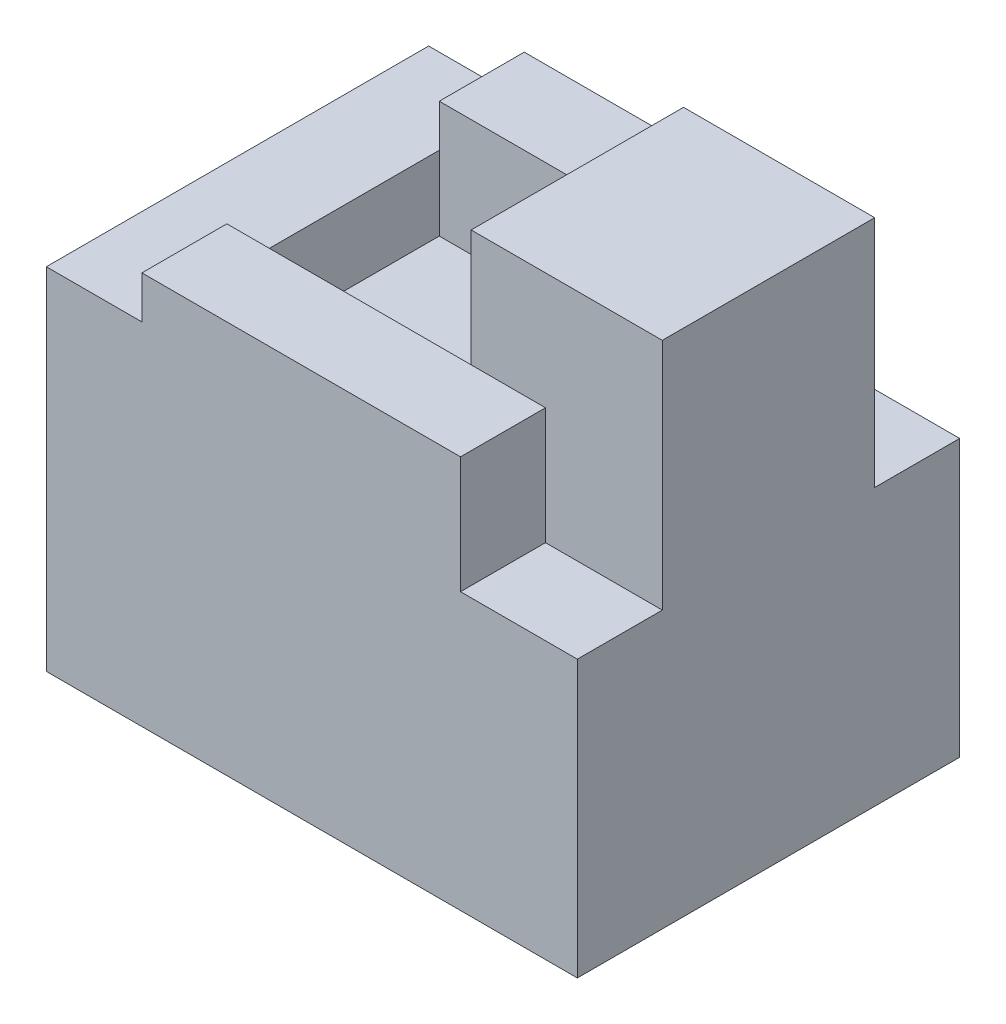
from build123d import *

# Parameters (mm, degrees)
SKETCH1_W           = 500
SKETCH1_H           = 360
BOSS_EXTRUDE1_DEPTH = 260
SKETCH2_W           = 90
SKETCH2_H           = 360
BOSS_EXTRUDE3_DEPTH = 70
SKETCH3_W           = 300
SKETCH3_H           = 80
BOSS_EXTRUDE4_DEPTH = 110
SKETCH4_W           = 180
SKETCH4_H           = 200
BOSS_EXTRUDE5_DEPTH = 220


with BuildPart() as part:
    # Sketch1 → Boss-Extrude1 (new body)
    with BuildSketch(Plane(origin=(0, 0, 0), x_dir=(1, 0, 0), z_dir=(0, 1, 0))):
        with Locations((250, 180)):
            Rectangle(SKETCH1_W, SKETCH1_H)
    extrude(amount=-BOSS_EXTRUDE1_DEPTH)

    # Sketch2 → Boss-Extrude3 (add)
    with BuildSketch(Plane(origin=(0, 0, 0), x_dir=(1, 0, 0), z_dir=(0, 1, 0))):
        with Locations((45, 180)):
            Rectangle(SKETCH2_W, SKETCH2_H)
    extrude(amount=BOSS_EXTRUDE3_DEPTH)

    # Sketch3 → Boss-Extrude4 (add)
    with BuildSketch(Plane(origin=(0, 0, 0), x_dir=(1, 0, 0), z_dir=(0, 1, 0))):
        with Locations((240, 320)):
            Rectangle(SKETCH3_W, SKETCH3_H)
        with Locations((240, 40)):
            Rectangle(SKETCH3_W, SKETCH3_H)
    extrude(amount=BOSS_EXTRUDE4_DEPTH)

    # Sketch4 → Boss-Extrude5 (add)
    with BuildSketch(Plane(origin=(0, 0, 0), x_dir=(1, 0, 0), z_dir=(0, 1, 0))):
        with Locations((410, 180)):
            Rectangle(SKETCH4_W, SKETCH4_H)
    extrude(amount=BOSS_EXTRUDE5_DEPTH)


solid = part.part
